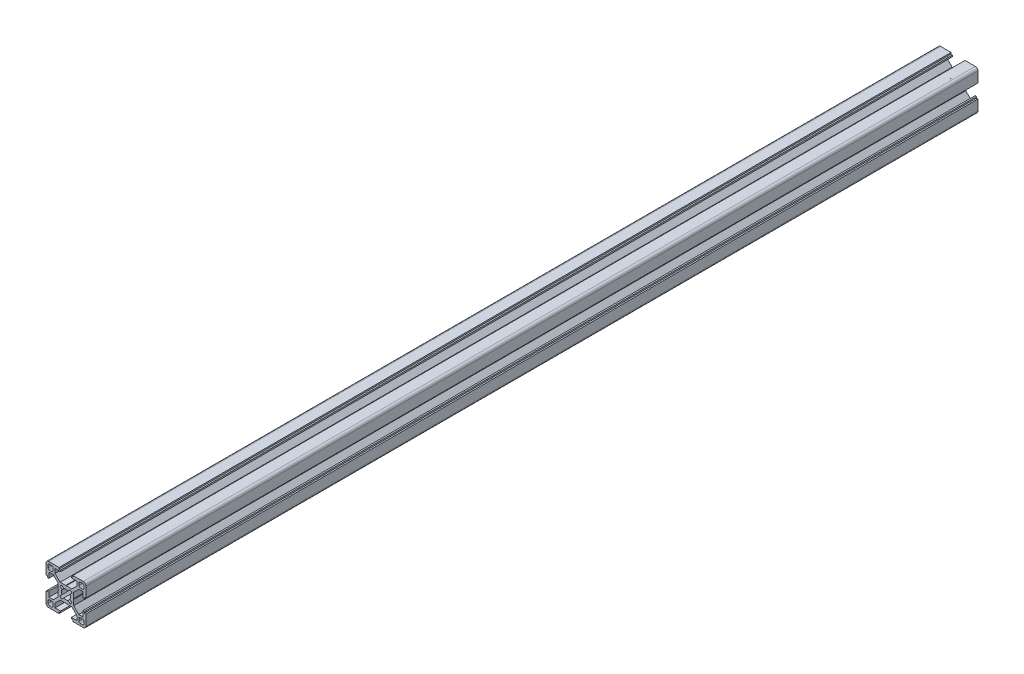
from build123d import *

# Parameters (mm, degrees)
BOSS_EXTRUDE1_DEPTH = 335


with BuildPart() as part:
    # Sketch1 → Boss-Extrude1 (new, symmetric)
    with BuildSketch(Plane.XY):
        with BuildLine():
            Line((0, -5.55), (0.25, -5.8))
            Line((0.25, -5.8), (4.385786438, -5.8))
            Line((4.385786438, -5.8), (8.2, -9.614213562))
            Line((8.2, -9.614213562), (8.2, -12.8))
            Line((8.2, -12.8), (4.1, -12.8))
            Line((4.1, -12.8), (4.1, -13.9))
            Line((4.1, -13.9), (5.2, -13.9))
            Line((5.2, -13.9), (5.2, -15))
            Line((5.2, -15), (13, -15))
            ThreePointArc((13, -15), (14.414213562, -14.414213562), (15, -13))
            Line((15, -13), (15, -5.2))
            Line((15, -5.2), (13.9, -5.2))
            Line((13.9, -5.2), (13.9, -4.1))
            Line((13.9, -4.1), (12.8, -4.1))
            Line((12.8, -4.1), (12.8, -8.2))
            Line((12.8, -8.2), (9.614213562, -8.2))
            Line((9.614213562, -8.2), (5.8, -4.385786438))
            Line((5.8, -4.385786438), (5.8, -0.25))
            Line((5.8, -0.25), (5.55, 0))
            Line((5.55, 0), (5.8, 0.25))
            Line((5.8, 0.25), (5.8, 4.385786438))
            Line((5.8, 4.385786438), (9.614213562, 8.2))
            Line((9.614213562, 8.2), (12.8, 8.2))
            Line((12.8, 8.2), (12.8, 4.1))
            Line((12.8, 4.1), (13.9, 4.1))
            Line((13.9, 4.1), (13.9, 5.2))
            Line((13.9, 5.2), (15, 5.2))
            Line((15, 5.2), (15, 13))
            ThreePointArc((15, 13), (14.414213562, 14.414213562), (13, 15))
            Line((13, 15), (5.2, 15))
            Line((5.2, 15), (5.2, 13.9))
            Line((5.2, 13.9), (4.1, 13.9))
            Line((4.1, 13.9), (4.1, 12.8))
            Line((4.1, 12.8), (8.2, 12.8))
            Line((8.2, 12.8), (8.2, 9.614213562))
            Line((8.2, 9.614213562), (4.385786438, 5.8))
            Line((4.385786438, 5.8), (0.25, 5.8))
            Line((0.25, 5.8), (0, 5.55))
            Line((0, 5.55), (-0.25, 5.8))
            Line((-0.25, 5.8), (-4.385786438, 5.8))
            Line((-4.385786438, 5.8), (-8.2, 9.614213562))
            Line((-8.2, 9.614213562), (-8.2, 12.8))
            Line((-8.2, 12.8), (-4.1, 12.8))
            Line((-4.1, 12.8), (-4.1, 13.9))
            Line((-4.1, 13.9), (-5.2, 13.9))
            Line((-5.2, 13.9), (-5.2, 15))
            Line((-5.2, 15), (-13, 15))
            ThreePointArc((-13, 15), (-14.414213562, 14.414213562), (-15, 13))
            Line((-15, 13), (-15, 5.2))
            Line((-15, 5.2), (-13.9, 5.2))
            Line((-13.9, 5.2), (-13.9, 4.1))
            Line((-13.9, 4.1), (-12.8, 4.1))
            Line((-12.8, 4.1), (-12.8, 8.2))
            Line((-12.8, 8.2), (-9.614213562, 8.2))
            Line((-9.614213562, 8.2), (-5.8, 4.385786438))
            Line((-5.8, 4.385786438), (-5.8, 0.25))
            Line((-5.8, 0.25), (-5.55, 0))
            Line((-5.55, 0), (-5.8, -0.25))
            Line((-5.8, -0.25), (-5.8, -4.385786438))
            Line((-5.8, -4.385786438), (-9.614213562, -8.2))
            Line((-9.614213562, -8.2), (-12.8, -8.2))
            Line((-12.8, -8.2), (-12.8, -4.1))
            Line((-12.8, -4.1), (-13.9, -4.1))
            Line((-13.9, -4.1), (-13.9, -5.2))
            Line((-13.9, -5.2), (-15, -5.2))
            Line((-15, -5.2), (-15, -13))
            ThreePointArc((-15, -13), (-14.414213562, -14.414213562), (-13, -15))
            Line((-13, -15), (-5.2, -15))
            Line((-5.2, -15), (-5.2, -13.9))
            Line((-5.2, -13.9), (-4.1, -13.9))
            Line((-4.1, -13.9), (-4.1, -12.8))
            Line((-4.1, -12.8), (-8.2, -12.8))
            Line((-8.2, -12.8), (-8.2, -9.614213562))
            Line((-8.2, -9.614213562), (-4.385786438, -5.8))
            Line((-4.385786438, -5.8), (-0.25, -5.8))
            Line((-0.25, -5.8), (0, -5.55))
        make_face()
        with BuildLine():
            Line((-13.5, 10.7), (-13.5, 12.5))
            ThreePointArc((-13.5, 12.5), (-13.207106781, 13.207106781), (-12.5, 13.5))
            Line((-12.5, 13.5), (-10.7, 13.5))
            ThreePointArc((-10.7, 13.5), (-9.992893219, 13.207106781), (-9.7, 12.5))
            Line((-9.7, 12.5), (-9.7, 10.7))
            ThreePointArc((-9.7, 10.7), (-9.992893219, 9.992893219), (-10.7, 9.7))
            Line((-10.7, 9.7), (-12.5, 9.7))
            ThreePointArc((-12.5, 9.7), (-13.207106781, 9.992893219), (-13.5, 10.7))
        make_face(mode=Mode.SUBTRACT)
        with BuildLine():
            Line((-13.5, -12.5), (-13.5, -10.7))
            ThreePointArc((-13.5, -10.7), (-13.207106781, -9.992893219), (-12.5, -9.7))
            Line((-12.5, -9.7), (-10.7, -9.7))
            ThreePointArc((-10.7, -9.7), (-9.992893219, -9.992893219), (-9.7, -10.7))
            Line((-9.7, -10.7), (-9.7, -12.5))
            ThreePointArc((-9.7, -12.5), (-9.992893219, -13.207106781), (-10.7, -13.5))
            Line((-10.7, -13.5), (-12.5, -13.5))
            ThreePointArc((-12.5, -13.5), (-13.207106781, -13.207106781), (-13.5, -12.5))
        make_face(mode=Mode.SUBTRACT)
        with BuildLine():
            Line((13.5, -10.7), (13.5, -12.5))
            ThreePointArc((13.5, -12.5), (13.207106781, -13.207106781), (12.5, -13.5))
            Line((12.5, -13.5), (10.7, -13.5))
            ThreePointArc((10.7, -13.5), (9.992893219, -13.207106781), (9.7, -12.5))
            Line((9.7, -12.5), (9.7, -10.7))
            ThreePointArc((9.7, -10.7), (9.992893219, -9.992893219), (10.7, -9.7))
            Line((10.7, -9.7), (12.5, -9.7))
            ThreePointArc((12.5, -9.7), (13.207106781, -9.992893219), (13.5, -10.7))
        make_face(mode=Mode.SUBTRACT)
        with BuildLine():
            Line((13.5, 12.5), (13.5, 10.7))
            ThreePointArc((13.5, 10.7), (13.207106781, 9.992893219), (12.5, 9.7))
            Line((12.5, 9.7), (10.7, 9.7))
            ThreePointArc((10.7, 9.7), (9.992893219, 9.992893219), (9.7, 10.7))
            Line((9.7, 10.7), (9.7, 12.5))
            ThreePointArc((9.7, 12.5), (9.992893219, 13.207106781), (10.7, 13.5))
            Line((10.7, 13.5), (12.5, 13.5))
            ThreePointArc((12.5, 13.5), (13.207106781, 13.207106781), (13.5, 12.5))
        make_face(mode=Mode.SUBTRACT)
        with BuildLine():
            Line((-1.590718277, -3.00493184), (-3.181708535, -4.595922097))
            Line((-3.181708535, -4.595922097), (-4.595922097, -3.181708535))
            Line((-4.595922097, -3.181708535), (-3.00493184, -1.590718277))
            ThreePointArc((-3.00493184, -1.590718277), (-3.4, 0), (-3.00493184, 1.590718277))
            Line((-3.00493184, 1.590718277), (-4.595922097, 3.181708535))
            Line((-4.595922097, 3.181708535), (-3.181708535, 4.595922097))
            Line((-3.181708535, 4.595922097), (-1.590718277, 3.00493184))
            ThreePointArc((-1.590718277, 3.00493184), (0, 3.4), (1.590718277, 3.00493184))
            Line((1.590718277, 3.00493184), (3.181708535, 4.595922097))
            Line((3.181708535, 4.595922097), (4.595922097, 3.181708535))
            Line((4.595922097, 3.181708535), (3.00493184, 1.590718277))
            ThreePointArc((3.00493184, 1.590718277), (3.4, 0), (3.00493184, -1.590718277))
            Line((3.00493184, -1.590718277), (4.595922097, -3.181708535))
            Line((4.595922097, -3.181708535), (3.181708535, -4.595922097))
            Line((3.181708535, -4.595922097), (1.590718277, -3.00493184))
            ThreePointArc((1.590718277, -3.00493184), (0, -3.4), (-1.590718277, -3.00493184))
        make_face(mode=Mode.SUBTRACT)
    extrude(amount=BOSS_EXTRUDE1_DEPTH, both=True)


solid = part.part
